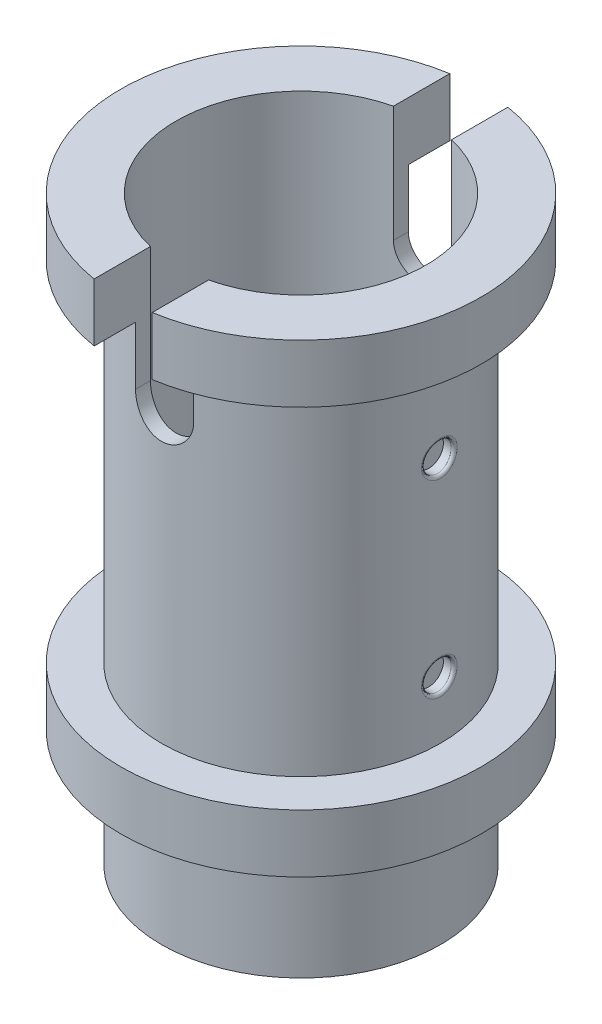
from build123d import *

# Parameters (mm, degrees)
SKETCH2_R               = 2.4
BOSS_EXTRUDE1_DEPTH     = 2
SKETCH3_R               = 3.1
BOSS_EXTRUDE2_DEPTH     = 1
SKETCH4_R               = 2.4
BOSS_EXTRUDE3_DEPTH     = 6
SKETCH5_R               = 3.1
BOSS_EXTRUDE4_DEPTH     = 1
CUT_EXTRUDE1_DEPTH      = 11.918791142
CUT_EXTRUDE1_DEPTH_BACK = 11.918791142
SKETCH7_R               = 0.25
CUT_EXTRUDE2_DEPTH      = 0.2
FILLET1_R               = 0.05
FILLET2_R               = 0.05
CUT_EXTRUDE3_DEPTH      = 11.918791142
CUT_EXTRUDE3_DEPTH_BACK = 11.918791142
SKETCH9_R               = 2.15


with BuildPart() as part:
    # Sketch2 → Boss-Extrude1 (new body)
    with BuildSketch(Plane(origin=(0, 0, 0), x_dir=(1, 0, 0), z_dir=(0, 1, 0))):
        with Locations(Location((0, 0, 0), (0, 0, 270))):
            Circle(SKETCH2_R)
    extrude(amount=BOSS_EXTRUDE1_DEPTH)

    # Sketch3 → Boss-Extrude2 (add)
    with BuildSketch(Plane(origin=(0, 2, 0), x_dir=(1, 0, 0), z_dir=(0, 1, 0))):
        with Locations(Location((0, 0, 0), (0, 0, 270))):
            Circle(SKETCH3_R)
    extrude(amount=BOSS_EXTRUDE2_DEPTH)

    # Sketch4 → Boss-Extrude3 (add)
    with BuildSketch(Plane(origin=(0, 3, 0), x_dir=(1, 0, 0), z_dir=(0, 1, 0))):
        with Locations(Location((0, 0, 0), (0, 0, 270))):
            Circle(SKETCH4_R)
    extrude(amount=BOSS_EXTRUDE3_DEPTH)

    # Sketch5 → Boss-Extrude4 (add)
    with BuildSketch(Plane(origin=(0, 9, 0), x_dir=(1, 0, 0), z_dir=(0, 1, 0))):
        with Locations(Location((0, 0, 0), (0, 0, 270))):
            Circle(SKETCH5_R)
    extrude(amount=BOSS_EXTRUDE4_DEPTH)

    # Sketch6 → Cut-Extrude1 (cut, two sides: drawn at the far end of the back side and taken through both)
    with BuildSketch(Plane.XY.offset(-CUT_EXTRUDE1_DEPTH_BACK)):
        with BuildLine():
            Line((0.5, 10), (0.5, 8))
            ThreePointArc((0.5, 8), (0, 7.5), (-0.5, 8))
            Line((-0.5, 8), (-0.5, 10))
            ThreePointArc((-0.5, 10), (0, 10.5), (0.5, 10))
        make_face()
    extrude(amount=CUT_EXTRUDE1_DEPTH + CUT_EXTRUDE1_DEPTH_BACK, mode=Mode.SUBTRACT)

    # Sketch7 → Cut-Extrude2 (cut)
    with BuildSketch(Plane(origin=(2.4, 0, 0), x_dir=(0, 0, -1), z_dir=(1, 0, 0))):
        with Locations((0, 7.248136305)):
            Circle(SKETCH7_R)
        with Locations((0, 3.994273363)):
            Circle(SKETCH7_R)
    extrude(amount=-CUT_EXTRUDE2_DEPTH, mode=Mode.SUBTRACT)

    # Fillet1
    fillet1_edges = [part.edges().sort_by_distance(p)[0] for p in [
        (2.386943652, 7.248136305, 0.25),
    ]]
    fillet(fillet1_edges, radius=FILLET1_R)

    # Fillet2
    fillet2_edges = [part.edges().sort_by_distance(p)[0] for p in [
        (2.386943652, 3.994273363, 0.25),
    ]]
    fillet(fillet2_edges, radius=FILLET2_R)

    # Sketch9 → Cut-Extrude3 (cut, two sides: drawn at the far end of the back side and taken through both)
    with BuildSketch(Plane(origin=(0, 0, 0), x_dir=(-1, 0, 0), z_dir=(0, -1, 0)).offset(-CUT_EXTRUDE3_DEPTH_BACK)):
        with Locations(Location((0, 0, 0), (0, 0, 103.447727045))):
            Circle(SKETCH9_R)
    extrude(amount=CUT_EXTRUDE3_DEPTH + CUT_EXTRUDE3_DEPTH_BACK, mode=Mode.SUBTRACT)


solid = part.part
